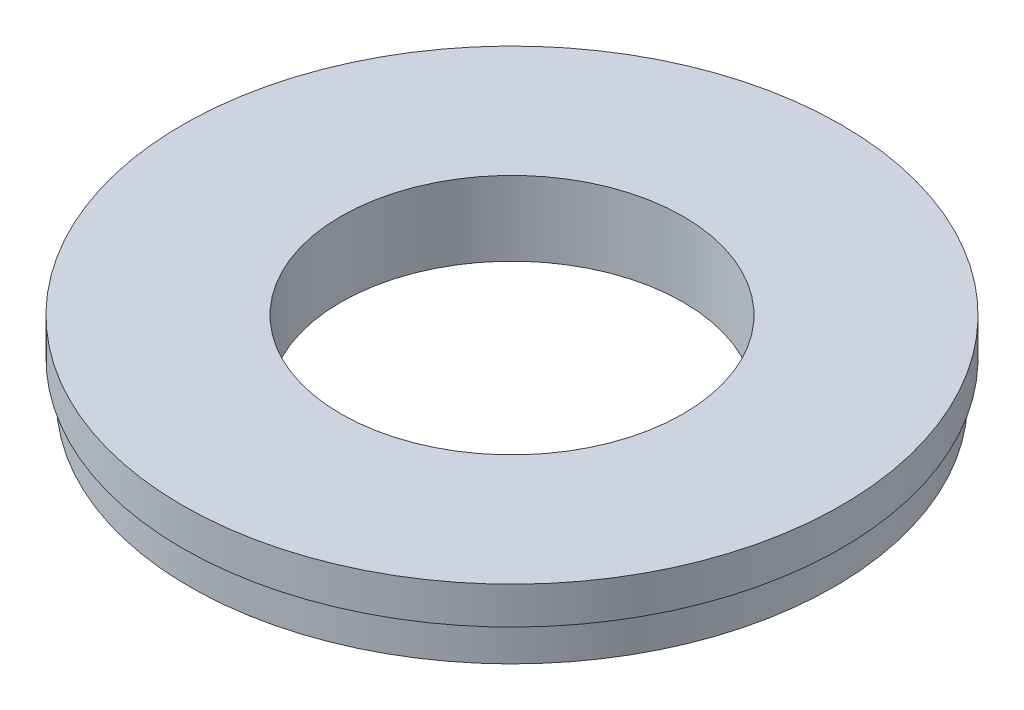
from build123d import *


with BuildPart() as part:
    # Sketch1 → Revolve1 (revolve)
    with BuildSketch(Plane.XY, mode=Mode.PRIVATE) as revolve1_sk:
        Polygon((27.5, 11.938), (52.959, 11.938), (52.959, 5.969), (51.7652, 5.969), (51.7652, 0), (27.5, 0), align=None)
    revolve(revolve1_sk.sketch.rotate(Axis((0, 0, 0), (0, 1, 0)), 90), axis=Axis((0, 0, 0), (0, 1, 0)))


solid = part.part
